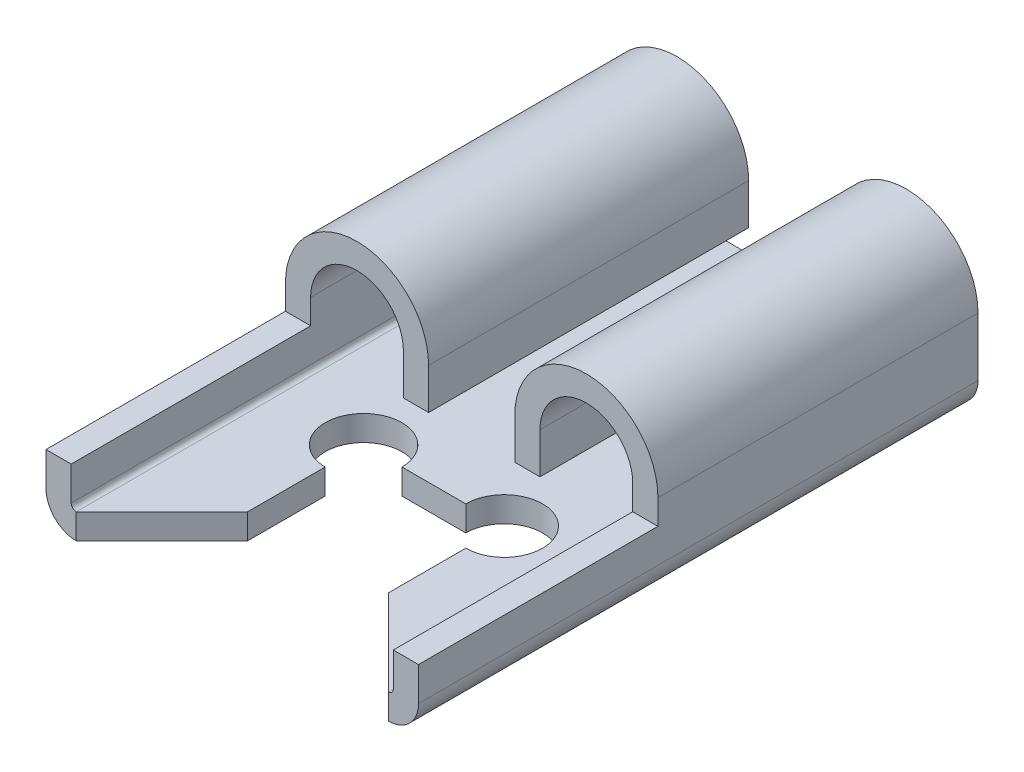
from build123d import *

# Parameters (mm, degrees)
BOSS_EXTRUDE1_DEPTH = 11.1
CUT_EXTRUDE1_REACH  = 14.123
CUT_EXTRUDE2_DEPTH  = 4.75


with BuildPart() as part:
    # Sketch1 → Boss-Extrude1 (new body)
    with BuildSketch(Plane.XY):
        with BuildLine():
            Line((0, 0), (-3.095, 0))
            ThreePointArc((-3.095, 0), (-3.519264069, 0.175735931), (-3.695, 0.6))
            Line((-3.695, 0.6), (-3.695, 1.76))
            ThreePointArc((-3.695, 1.76), (-2.275, 3.18), (-0.855, 1.76))
            Line((-0.855, 1.76), (-0.855, 0.95))
            Line((-0.855, 0.95), (-1.355, 0.95))
            Line((-1.355, 0.95), (-1.355, 1.76))
            ThreePointArc((-1.355, 1.76), (-2.275, 2.68), (-3.195, 1.76))
            Line((-3.195, 1.76), (-3.195, 0.6))
            ThreePointArc((-3.195, 0.6), (-3.165710678, 0.529289322), (-3.095, 0.5))
            Line((-3.095, 0.5), (0, 0.5))
            Line((0, 0.5), (3.095, 0.5))
            ThreePointArc((3.095, 0.5), (3.165710678, 0.529289322), (3.195, 0.6))
            Line((3.195, 0.6), (3.195, 1.76))
            ThreePointArc((3.195, 1.76), (2.275, 2.68), (1.355, 1.76))
            Line((1.355, 1.76), (1.355, 0.95))
            Line((1.355, 0.95), (0.855, 0.95))
            Line((0.855, 0.95), (0.855, 1.76))
            ThreePointArc((0.855, 1.76), (2.275, 3.18), (3.695, 1.76))
            Line((3.695, 1.76), (3.695, 0.6))
            ThreePointArc((3.695, 0.6), (3.519264069, 0.175735931), (3.095, 0))
            Line((3.095, 0), (0, 0))
        make_face()
    extrude(amount=-BOSS_EXTRUDE1_DEPTH)

    # Sketch2 → Cut-Extrude1 (cut, up to next)
    with BuildSketch(Plane.XZ, mode=Mode.PRIVATE) as cut_extrude1_sk1:
        with BuildLine():
            Line((-3.095, 0), (-1.395, -1.7))
            Line((-1.395, -1.7), (-1.395, -3.238))
            ThreePointArc((-1.395, -3.238), (-1.933815367, -4.538815367), (-0.633, -4))
            Line((-0.633, -4), (0.633, -4))
            ThreePointArc((0.633, -4), (1.933815367, -4.538815367), (1.395, -3.238))
            Line((1.395, -3.238), (1.395, -1.7))
            Line((1.395, -1.7), (3.095, 0))
            Line((3.095, 0), (3.095, 0.537500588))
            Line((3.095, 0.537500588), (-3.095, 0.537500588))
            Line((-3.095, 0.537500588), (-3.095, 0))
        make_face()
    cut_extrude1_tool1 = extrude(cut_extrude1_sk1.sketch, amount=-CUT_EXTRUDE1_REACH, mode=Mode.PRIVATE) & part.part
    add(cut_extrude1_tool1.solids().sort_by_distance((0, 0, -1.705502))[0], mode=Mode.SUBTRACT)

    # Sketch3 → Cut-Extrude2 (cut)
    with BuildSketch(Plane.XY):
        Polygon((-3.695, 3.311724778), (3.695, 3.311724778), (3.695, 1.27), (3.095, 1.27), (3.095, 0.77), (-3.095, 0.77), (-3.095, 1.27), (-3.695, 1.27), align=None)
    extrude(amount=-CUT_EXTRUDE2_DEPTH, mode=Mode.SUBTRACT)


solid = part.part
